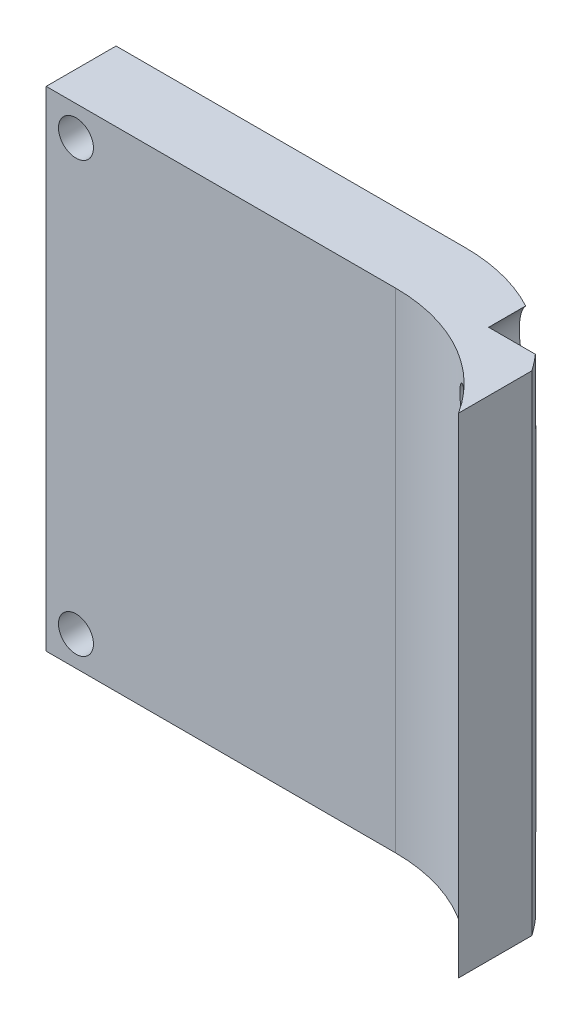
from build123d import *

# Parameters (mm, degrees)
CROQUIS1_W                 = 35
CROQUIS1_H                 = 35
CROQUIS1_R                 = 1.25
SALIENTE_EXTRUIR1_DEPTH    = 5
SALIENTE_EXTRUIR2_DEPTH    = 35
CORTAR_EXTRUIR2_DEPTH      = 41.51542916
CORTAR_EXTRUIR2_DEPTH_BACK = 41.51542916
CROQUIS4_R                 = 1.25
CORTAR_EXTRUIR3_DEPTH      = 10
CROQUIS5_R                 = 3
CORTAR_EXTRUIR6_DEPTH      = 4.1


with BuildPart() as part:
    # Croquis1 → Saliente-Extruir1 (new body)
    with BuildSketch(Plane.XY):
        Rectangle(CROQUIS1_W, CROQUIS1_H)
        with Locations((15.37, -15.37)):
            Circle(CROQUIS1_R, mode=Mode.SUBTRACT)
        with Locations((-15.37, -15.37)):
            Circle(CROQUIS1_R, mode=Mode.SUBTRACT)
        with Locations((-15.37, 15.37)):
            Circle(CROQUIS1_R, mode=Mode.SUBTRACT)
        with Locations((15.37, 15.37)):
            Circle(CROQUIS1_R, mode=Mode.SUBTRACT)
    extrude(amount=SALIENTE_EXTRUIR1_DEPTH)

    # Croquis2 → Saliente-Extruir2 (add, through all)
    with BuildSketch(Plane(origin=(0, 17.5, 0), x_dir=(1, 0, 0), z_dir=(0, 1, 0))):
        with BuildLine():
            Line((17.5, -5), (17.5, -10.5))
            ThreePointArc((17.5, -10.5), (13.206356105, -6.465716172), (7.5, -5))
            Line((7.5, -5), (17.5, -5))
        make_face()
    extrude(amount=-SALIENTE_EXTRUIR2_DEPTH)

    # Croquis3 → Cortar-Extruir2 (cut, two sides: drawn at the far end of the back side and taken through both)
    with BuildSketch(Plane(origin=(0, 17.5, 0), x_dir=(1, 0, 0), z_dir=(0, 1, 0)).offset(-CORTAR_EXTRUIR2_DEPTH_BACK)):
        with BuildLine():
            Line((17.5, 0), (7.5, 0))
            ThreePointArc((7.5, 0), (13.147178499, -1.392279049), (17.5, -5.25))
            Line((17.5, -5.25), (17.5, 0))
        make_face()
    extrude(amount=CORTAR_EXTRUIR2_DEPTH + CORTAR_EXTRUIR2_DEPTH_BACK, mode=Mode.SUBTRACT)

    # Croquis4 → Cortar-Extruir3 (cut)
    with BuildSketch(Plane(origin=(0, 0, 5), x_dir=(-1, 0, 0), z_dir=(0, 0, -1))):
        with Locations((-15.37, 15.37)):
            Circle(CROQUIS4_R)
        with Locations((-15.37, -15.37)):
            Circle(CROQUIS4_R)
    extrude(amount=-CORTAR_EXTRUIR3_DEPTH, mode=Mode.SUBTRACT)

    # Croquis5 → Cortar-Extruir6 (cut)
    with BuildSketch(Plane(origin=(0, 0, 0), x_dir=(-1, 0, 0), z_dir=(0, 0, -1))):
        with Locations((-15.37, 15.37)):
            Circle(CROQUIS5_R)
        with Locations((-15.37, -15.37)):
            Circle(CROQUIS5_R)
    extrude(amount=-CORTAR_EXTRUIR6_DEPTH, mode=Mode.SUBTRACT)


solid = part.part
